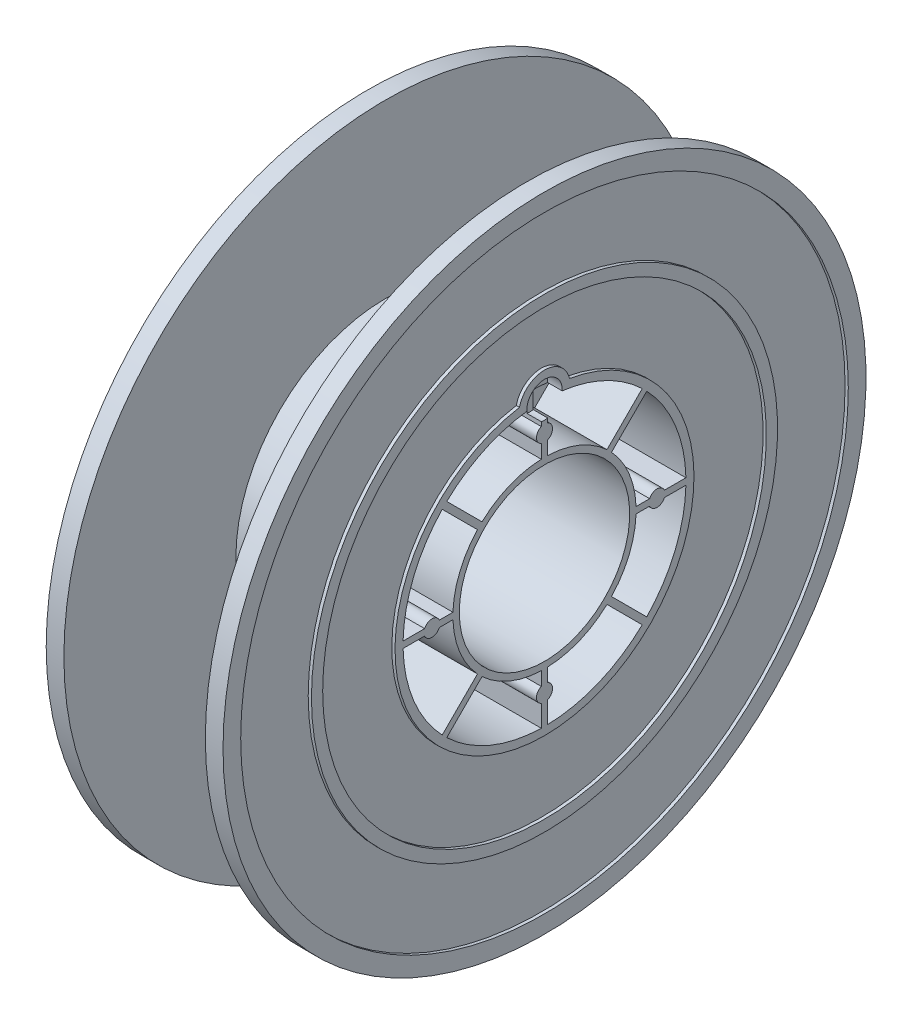
from build123d import *

# Parameters (mm, degrees)
SKETCH1_W           = 55
SKETCH1_H           = 2
BOSS_EXTRUDE1_START = 5
SKETCH2_R           = 46.5
SKETCH2_R_2         = 26.5
BOSS_EXTRUDE1_DEPTH = 2
EXTRUDE_THIN1_REACH = 153.74
SKETCH3_W           = 2
SKETCH3_H           = 17.5
SKETCH3_W_2         = 17.5
SKETCH3_H_2         = 2
SKETCH4_R           = 2.5
BOSS_EXTRUDE2_DEPTH = 22.5
BOSS_EXTRUDE3_START = -2
BOSS_EXTRUDE3_DEPTH = 2
SKETCH6_R           = 5.5
CUT_EXTRUDE1_DEPTH  = 4.5


with BuildPart() as part:
    # Sketch1 → Revolve1 (revolve)
    with BuildSketch(Plane.XY, mode=Mode.PRIVATE) as revolve1_sk:
        with Locations((0, 27.5)):
            Rectangle(SKETCH1_W, SKETCH1_H)
        Polygon((-22, 100), (-22, 46.5), (22, 46.5), (22, 100), (27.5, 100), (27.5, 94.5), (26.5, 94.5), (26.5, 72.5), (27.5, 72.5), (27.5, 69), (26.5, 69), (26.5, 46.5), (27.5, 46.5), (27.5, 44), (-27.5, 44), (-27.5, 46.5), (-26.5, 46.5), (-26.5, 69), (-27.5, 69), (-27.5, 72.5), (-26.5, 72.5), (-26.5, 94.5), (-27.5, 94.5), (-27.5, 100), align=None)
    revolve(revolve1_sk.sketch.rotate(Axis((0, 0, 0), (1, 0, 0)), 90), axis=Axis((0, 0, 0), (1, 0, 0)))

    # Sketch2 → Boss-Extrude1 (add)
    with BuildSketch(Plane(origin=(0, 0, 0), x_dir=(0, 0, -1), z_dir=(1, 0, 0)).offset(BOSS_EXTRUDE1_START)):
        with Locations(Location((0, 0, 0), (0, 0, 180))):
            Circle(SKETCH2_R)
        with Locations(Location((0, 0, 0), (0, 0, 180))):
            Circle(SKETCH2_R_2, mode=Mode.SUBTRACT)
    extrude(amount=-BOSS_EXTRUDE1_DEPTH)

    # Extrude-Thin1: up to this face of the body (flat: up to its plane)
    extrude_thin1_end = Plane(part.part.faces().sort_by_distance((27.5, 0, -45.184781387))[0])
    # Sketch3 → Extrude-Thin1 (add, up to the picked face)
    with BuildSketch(Plane.ZY.offset(27.5), mode=Mode.PRIVATE) as extrude_thin1_sk1:
        with Locations((0, 35.25)):
            Rectangle(SKETCH3_W, SKETCH3_H)
    extrude_thin1_tool1 = split(extrude(extrude_thin1_sk1.sketch, amount=-EXTRUDE_THIN1_REACH, mode=Mode.PRIVATE), bisect_by=extrude_thin1_end, keep=Keep.BOTH, mode=Mode.PRIVATE)
    # Sketch3 → Extrude-Thin1 (add, up to the picked face)
    with BuildSketch(Plane.ZY.offset(27.5), mode=Mode.PRIVATE) as extrude_thin1_sk2:
        with Locations((0, -35.25)):
            Rectangle(SKETCH3_W, SKETCH3_H)
    extrude_thin1_tool2 = split(extrude(extrude_thin1_sk2.sketch, amount=-EXTRUDE_THIN1_REACH, mode=Mode.PRIVATE), bisect_by=extrude_thin1_end, keep=Keep.BOTH, mode=Mode.PRIVATE)
    # Sketch3 → Extrude-Thin1 (add, up to the picked face)
    with BuildSketch(Plane.ZY.offset(27.5), mode=Mode.PRIVATE) as extrude_thin1_sk3:
        with Locations((35.25, 0)):
            Rectangle(SKETCH3_W_2, SKETCH3_H_2)
    extrude_thin1_tool3 = split(extrude(extrude_thin1_sk3.sketch, amount=-EXTRUDE_THIN1_REACH, mode=Mode.PRIVATE), bisect_by=extrude_thin1_end, keep=Keep.BOTH, mode=Mode.PRIVATE)
    # Sketch3 → Extrude-Thin1 (add, up to the picked face)
    with BuildSketch(Plane.ZY.offset(27.5), mode=Mode.PRIVATE) as extrude_thin1_sk4:
        with Locations((-35.25, 0)):
            Rectangle(SKETCH3_W_2, SKETCH3_H_2)
    extrude_thin1_tool4 = split(extrude(extrude_thin1_sk4.sketch, amount=-EXTRUDE_THIN1_REACH, mode=Mode.PRIVATE), bisect_by=extrude_thin1_end, keep=Keep.BOTH, mode=Mode.PRIVATE)
    # Sketch3 → Extrude-Thin1 (add, up to the picked face)
    with BuildSketch(Plane.ZY.offset(27.5), mode=Mode.PRIVATE) as extrude_thin1_sk5:
        Polygon((-18.03122292, 19.445436483), (-30.405591591, 31.819805153), (-31.819805153, 30.405591591), (-19.445436483, 18.03122292), align=None)
    extrude_thin1_tool5 = split(extrude(extrude_thin1_sk5.sketch, amount=-EXTRUDE_THIN1_REACH, mode=Mode.PRIVATE), bisect_by=extrude_thin1_end, keep=Keep.BOTH, mode=Mode.PRIVATE)
    # Sketch3 → Extrude-Thin1 (add, up to the picked face)
    with BuildSketch(Plane.ZY.offset(27.5), mode=Mode.PRIVATE) as extrude_thin1_sk6:
        Polygon((18.03122292, -19.445436483), (30.405591591, -31.819805153), (31.819805153, -30.405591591), (19.445436483, -18.03122292), align=None)
    extrude_thin1_tool6 = split(extrude(extrude_thin1_sk6.sketch, amount=-EXTRUDE_THIN1_REACH, mode=Mode.PRIVATE), bisect_by=extrude_thin1_end, keep=Keep.BOTH, mode=Mode.PRIVATE)
    # Sketch3 → Extrude-Thin1 (add, up to the picked face)
    with BuildSketch(Plane.ZY.offset(27.5), mode=Mode.PRIVATE) as extrude_thin1_sk7:
        Polygon((19.445436483, 18.03122292), (31.819805153, 30.405591591), (30.405591591, 31.819805153), (18.03122292, 19.445436483), align=None)
    extrude_thin1_tool7 = split(extrude(extrude_thin1_sk7.sketch, amount=-EXTRUDE_THIN1_REACH, mode=Mode.PRIVATE), bisect_by=extrude_thin1_end, keep=Keep.BOTH, mode=Mode.PRIVATE)
    # Sketch3 → Extrude-Thin1 (add, up to the picked face)
    with BuildSketch(Plane.ZY.offset(27.5), mode=Mode.PRIVATE) as extrude_thin1_sk8:
        Polygon((-19.445436483, -18.03122292), (-31.819805153, -30.405591591), (-30.405591591, -31.819805153), (-18.03122292, -19.445436483), align=None)
    extrude_thin1_tool8 = split(extrude(extrude_thin1_sk8.sketch, amount=-EXTRUDE_THIN1_REACH, mode=Mode.PRIVATE), bisect_by=extrude_thin1_end, keep=Keep.BOTH, mode=Mode.PRIVATE)
    add(extrude_thin1_tool1.solids().sort_by(Axis((-27.5, 35.25, 0), (1, 0, 0)))[0])
    add(extrude_thin1_tool2.solids().sort_by(Axis((-27.5, -35.25, 0), (1, 0, 0)))[0])
    add(extrude_thin1_tool3.solids().sort_by(Axis((-27.5, 0, 35.25), (1, 0, 0)))[0])
    add(extrude_thin1_tool4.solids().sort_by(Axis((-27.5, 0, -35.25), (1, 0, 0)))[0])
    add(extrude_thin1_tool5.solids().sort_by(Axis((-27.5, 24.925514, -24.925514), (1, 0, 0)))[0])
    add(extrude_thin1_tool6.solids().sort_by(Axis((-27.5, -24.925514, 24.925514), (1, 0, 0)))[0])
    add(extrude_thin1_tool7.solids().sort_by(Axis((-27.5, 24.925514, 24.925514), (1, 0, 0)))[0])
    add(extrude_thin1_tool8.solids().sort_by(Axis((-27.5, -24.925514, -24.925514), (1, 0, 0)))[0])

    # Sketch4 → Boss-Extrude2 (add)
    with BuildSketch(Plane(origin=(27.5, 0, 0), x_dir=(0, 0, -1), z_dir=(1, 0, 0))):
        with Locations((0, 35)):
            Circle(SKETCH4_R)
        with Locations((35, 0)):
            Circle(SKETCH4_R)
        with Locations((0, -35)):
            Circle(SKETCH4_R)
        with Locations((-35, 0)):
            Circle(SKETCH4_R)
    extrude(amount=-BOSS_EXTRUDE2_DEPTH)

    # Sketch5 → Boss-Extrude3 (add)
    with BuildSketch(Plane(origin=(27.5, 0, 0), x_dir=(0, 0, -1), z_dir=(1, 0, 0)).offset(BOSS_EXTRUDE3_START)):
        with BuildLine():
            ThreePointArc((7.966873564, 43.272727273), (0, 52), (-7.966873564, 43.272727273))
            ThreePointArc((-7.966873564, 43.272727273), (0, 44), (7.966873564, 43.272727273))
        make_face()
    boss_extrude3 = extrude(amount=BOSS_EXTRUDE3_DEPTH)

    # Sketch6 → Cut-Extrude1 (cut)
    with BuildSketch(Plane(origin=(27.5, 0, 0), x_dir=(0, 0, -1), z_dir=(1, 0, 0))):
        with Locations((0, 44)):
            Circle(SKETCH6_R)
    cut_extrude1 = extrude(amount=-CUT_EXTRUDE1_DEPTH, mode=Mode.SUBTRACT)

    # Mirror1: Boss-Extrude3, Cut-Extrude1 across plane
    add(boss_extrude3.mirror(Plane(origin=(0, 0, 0), x_dir=(0, 0, 1), z_dir=(1, 0, 0))))
    add(cut_extrude1.mirror(Plane(origin=(0, 0, 0), x_dir=(0, 0, 1), z_dir=(1, 0, 0))), mode=Mode.SUBTRACT)


solid = part.part
